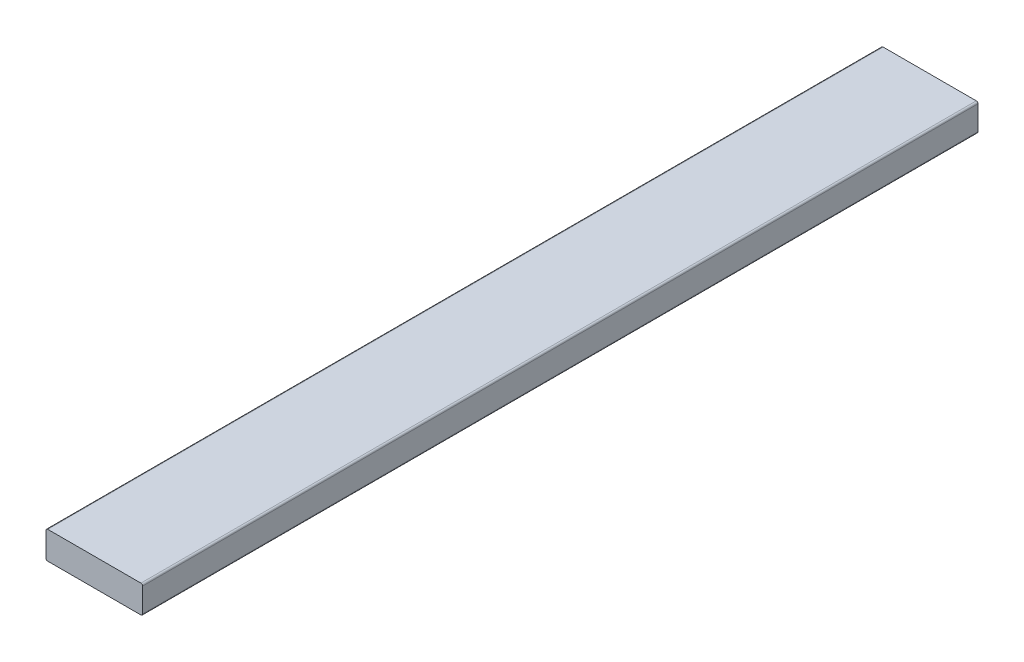
from build123d import *

# Parameters (mm, degrees)
SKETCH1_W           = 88.9
SKETCH1_H           = 25.4
BOSS_EXTRUDE1_DEPTH = 768.35
FILLET1_R           = 1.5875


with BuildPart() as part:
    # Sketch1 → Boss-Extrude1 (new body)
    with BuildSketch(Plane.XY):
        Rectangle(SKETCH1_W, SKETCH1_H)
    extrude(amount=BOSS_EXTRUDE1_DEPTH)

    # Fillet1
    fillet1_edges = [part.edges().sort_by_distance(p)[0] for p in [
        (44.45, -12.7, 384.175),
        (-44.45, -12.7, 384.175),
        (-44.45, 12.7, 384.175),
        (44.45, 12.7, 384.175),
    ]]
    fillet(fillet1_edges, radius=FILLET1_R)


solid = part.part
